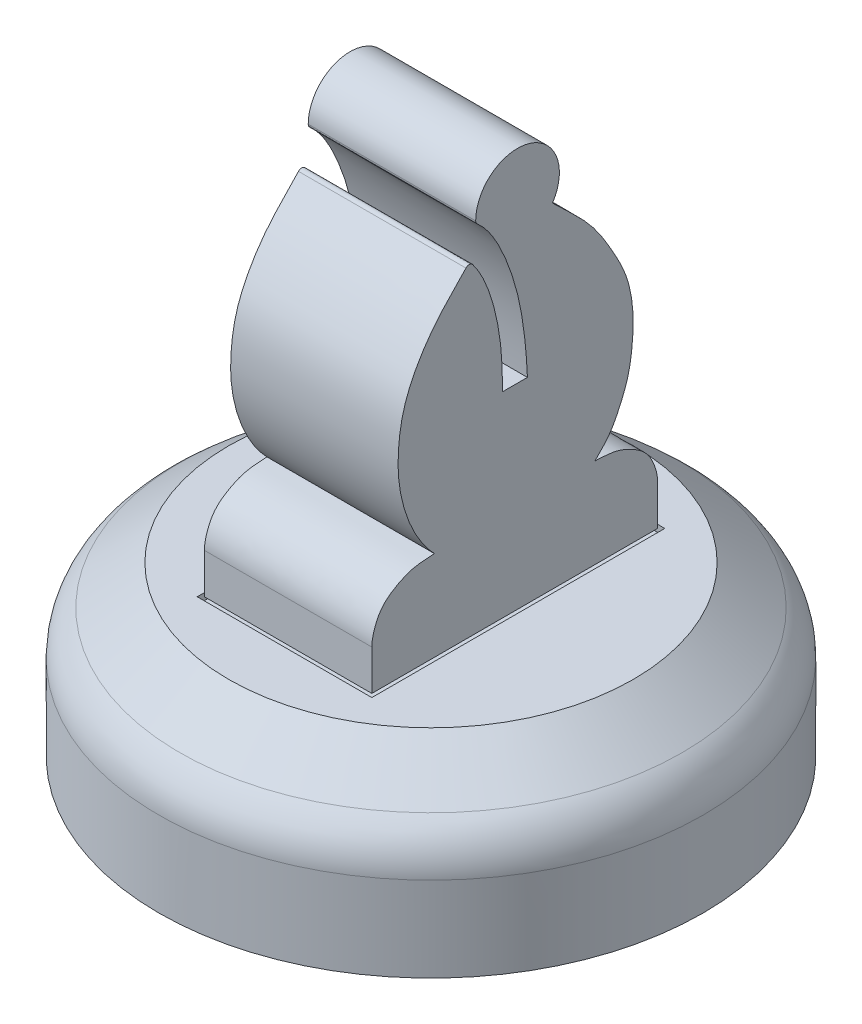
from build123d import *

# Parameters (mm, degrees)
SKETCH1_R                  = 15.478125
BOSS_EXTRUDE1_DEPTH        = 6.35
FILLET1_R                  = 3.175
SKETCH3_W                  = 12.9032
SKETCH3_H                  = 19.2532
CUT_EXTRUDE1_DEPTH         = 4.7625
F_6_0_204_DIAMETER_HOLE1_D = 5.1816
BOSS_EXTRUDE2_DEPTH        = 4.7625
SKETCH7_W                  = 9.9314
SKETCH7_H                  = 16.6624
CUT_EXTRUDE2_DEPTH         = 0.396875
FILLET2_R                  = 0.254


with BuildPart() as part:
    # Sketch1 → Boss-Extrude1 (new body)
    with BuildSketch(Plane(origin=(0, 0, 0), x_dir=(1, 0, 0), z_dir=(0, 1, 0))):
        with Locations(Location((0, 0, 0), (0, 0, 270))):
            Circle(SKETCH1_R)
    extrude(amount=BOSS_EXTRUDE1_DEPTH)

    # Sketch2 → Revolve1 (revolve)
    with BuildSketch(Plane.XY, mode=Mode.PRIVATE) as revolve1_sk:
        Polygon((-15.478125, 6.35), (-11.509375, 9.525), (0, 9.525), (0, 6.35), align=None)
    revolve(revolve1_sk.sketch.rotate(Axis((0, 9.525, 0), (0, -1, 0)), 270), axis=Axis((0, 9.525, 0), (0, -1, 0)))

    # Fillet1
    fillet1_edges = [part.edges().sort_by_distance(p)[0] for p in [
        (0, 6.35, -15.478125),
    ]]
    fillet(fillet1_edges, radius=FILLET1_R)

    # Sketch3 → Cut-Extrude1 (cut)
    with BuildSketch(Plane.XZ):
        Rectangle(SKETCH3_W, SKETCH3_H)
    extrude(amount=-CUT_EXTRUDE1_DEPTH, mode=Mode.SUBTRACT)

    # #6 (0.204) Diameter Hole1 (through all)
    with Locations(Plane(origin=(0, 4.7625, 0), x_dir=(-1, 0, 0), z_dir=(0, -1, 0))):
        with Locations((0, 0)):
            Hole(F_6_0_204_DIAMETER_HOLE1_D / 2)

    # Sketch7 → Cut-Extrude2 (cut)
    with BuildSketch(Plane(origin=(0, 9.525, 0), x_dir=(1, 0, 0), z_dir=(0, 1, 0))):
        Rectangle(SKETCH7_W, SKETCH7_H)
    extrude(amount=-CUT_EXTRUDE2_DEPTH, mode=Mode.SUBTRACT)


with BuildPart() as body_2:
    # Sketch6 → Boss-Extrude2 (new, symmetric)
    with BuildSketch(Plane(origin=(0, 0, 0), x_dir=(0, 0, -1), z_dir=(1, 0, 0))):
        with BuildLine():
            Line((8.128, 9.525), (-8.128, 9.525))
            Line((-8.128, 9.525), (-8.128, 11.811))
            add(Edge.make_bspline(
                [(-8.128, 11.811), (-8.128, 11.964852962), (-8.088079655, 12.287813543), (-7.921013245, 12.821816315), (-7.660538801, 13.367431776), (-7.237258139, 13.799641498), (-6.787221355, 14.093437893), (-6.359189094, 14.317391584), (-5.631174455, 14.592045574), (-5.018563189, 14.606056956), (-4.567466527, 14.633133736)],
                knots=[0, 0, 0, 0, 0.091821989, 0.189225593, 0.331099539, 0.444001016, 0.541829554, 0.647961243, 0.729130912, 1, 1, 1, 1], degree=3))
            add(Edge.make_bspline(
                [(-2.577145361, 28.011214997), (-3.249090894, 27.302251357), (-4.468621829, 26.127878484), (-5.648431076, 24.316983957), (-6.331714614, 22.737632088), (-6.634320692, 21.102092731), (-6.672666305, 19.026055349), (-6.063547868, 16.704846476), (-5.151631515, 15.238050676), (-4.567466527, 14.633133736)],
                knots=[0, 0, 0, 0, 0.193953117, 0.33367751, 0.425378511, 0.533262364, 0.661023728, 0.834598476, 1, 1, 1, 1], degree=3))
            add(Edge.make_bspline(
                [(-0.702792016, 20.668406325), (-0.674457315, 21.895013355), (-0.802393308, 23.705263943), (-1.470587145, 26.198121163), (-2.064569458, 27.420151061), (-2.577145361, 28.011214997)],
                knots=[0, 0, 0, 0, 0.47713647, 0.699696539, 1, 1, 1, 1], degree=3))
            Line((-0.702792016, 20.668406325), (0.721519658, 20.668406325))
            add(Edge.make_bspline(
                [(-2.2178236, 29.730237714), (-1.62152233, 29.238401482), (-0.995355422, 28.244447346), (-0.327091027, 26.70344874), (0.440040308, 24.337086176), (0.650497256, 22.227916002), (0.721519658, 20.668406325)],
                knots=[0, 0, 0, 0, 0.236294145, 0.354063326, 0.517816971, 1, 1, 1, 1], degree=3))
            ThreePointArc((-2.2178236, 29.730237714), (0.784549677, 32.149320423), (2.147254802, 28.542487853))
            add(Edge.make_bspline(
                [(4.567466527, 14.633133736), (4.865331001, 14.934983024), (5.40910627, 15.474406408), (5.969261062, 16.573568683), (6.457374558, 17.72899292), (6.744619539, 19.444714149), (6.78563689, 21.198431759), (6.338072925, 23.051026424), (5.668765308, 24.293311401), (4.965580349, 25.505426492), (4.301495841, 26.419369028), (3.305311631, 27.453348329), (2.598548076, 28.097487401), (2.147254802, 28.542487853)],
                knots=[0, 0, 0, 0, 0.080158756, 0.141654265, 0.230515184, 0.314788546, 0.467006335, 0.556741952, 0.669627033, 0.730468918, 0.820323986, 0.880912548, 1, 1, 1, 1], degree=3))
            add(Edge.make_bspline(
                [(8.128, 11.811), (8.128, 11.964852962), (8.088079655, 12.287813543), (7.921013245, 12.821816315), (7.660538801, 13.367431776), (7.237258139, 13.799641498), (6.787221355, 14.093437893), (6.359189094, 14.317391584), (5.631174455, 14.592045574), (5.018563189, 14.606056956), (4.567466527, 14.633133736)],
                knots=[0, 0, 0, 0, 0.091821989, 0.189225593, 0.331099539, 0.444001016, 0.541829554, 0.647961243, 0.729130912, 1, 1, 1, 1], degree=3))
            Line((8.128, 11.811), (8.128, 9.525))
        make_face()
    extrude(amount=BOSS_EXTRUDE2_DEPTH, both=True)

    # Fillet2
    fillet2_edges = [body_2.edges().sort_by_distance(p)[0] for p in [
        (2.38125, 28.011214997, 2.577145361),
        (-2.38125, 29.730237714, 2.2178236),
    ]]
    fillet(fillet2_edges, radius=FILLET2_R)


solid = Compound([part.part, body_2.part])
